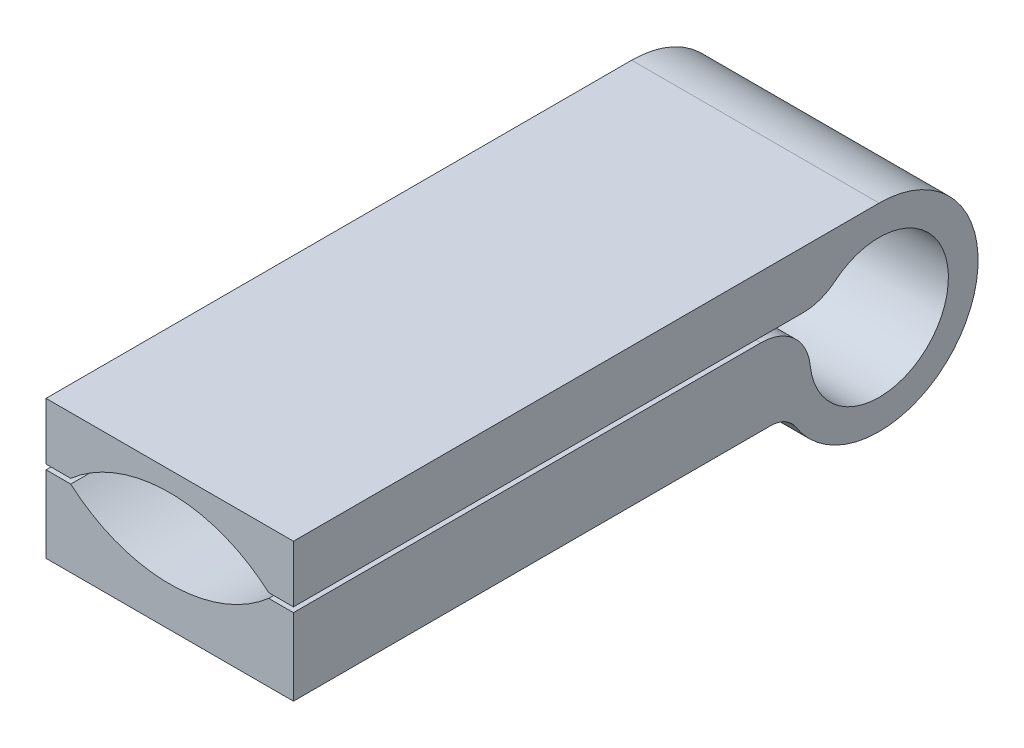
from build123d import *

# Parameters (mm, degrees)
BOSS_EXTRUDE2_DEPTH = 25
CUT_EXTRUDE1_REACH  = 76.865
SKETCH5_R           = 2.5
CUT_EXTRUDE4_DEPTH  = 51.520709


with BuildPart() as part:
    # Sketch2 → Boss-Extrude2 (new body)
    with BuildSketch(Plane(origin=(0, 0, 0), x_dir=(0, 0, -1), z_dir=(1, 0, 0))):
        with BuildLine():
            Line((0, 0), (59.16515139, 0))
            ThreePointArc((59.16515139, 0), (67.935731583, -14.803844614), (50.738650505, -15.384615385))
            ThreePointArc((50.738650505, -15.384615385), (49.651853624, -14.368825942), (48.21070024, -14))
            Line((48.21070024, -14), (45, -14))
            Line((45, -14), (0, -14))
            Line((0, -14), (0, -6.25))
            Line((0, -6.25), (47.230433128, -6.25))
            ThreePointArc((47.230433128, -6.25), (50.576761962, -7.534884479), (52.203232404, -10.729166667))
            ThreePointArc((52.203232404, -10.729166667), (65.645099511, -12.64769189), (54.705893308, -4.604166667))
            ThreePointArc((54.705893308, -4.604166667), (53.213216965, -5.454829079), (51.520708964, -5.75))
            Line((51.520708964, -5.75), (0, -5.75))
            Line((0, -5.75), (0, 0))
        make_face()
    extrude(amount=BOSS_EXTRUDE2_DEPTH)

    # Sketch5 → Cut-Extrude1 (cut, up to next)
    with BuildSketch(Plane.XZ.offset(14), mode=Mode.PRIVATE) as cut_extrude1_sk1:
        with Locations(Location((12.5, -30.56070024, 0), (0, 0, 270))):
            Circle(SKETCH5_R)
    cut_extrude1_tool1 = extrude(cut_extrude1_sk1.sketch, amount=-CUT_EXTRUDE1_REACH, mode=Mode.PRIVATE) & part.part
    # Sketch5 → Cut-Extrude1 (cut, up to next)
    with BuildSketch(Plane.XZ.offset(14), mode=Mode.PRIVATE) as cut_extrude1_sk2:
        with Locations(Location((12.5, -38.19070024, 0), (0, 0, 270))):
            Circle(SKETCH5_R)
    cut_extrude1_tool2 = extrude(cut_extrude1_sk2.sketch, amount=-CUT_EXTRUDE1_REACH, mode=Mode.PRIVATE) & part.part
    # Sketch5 → Cut-Extrude1 (cut, up to next)
    with BuildSketch(Plane.XZ.offset(14), mode=Mode.PRIVATE) as cut_extrude1_sk3:
        with Locations(Location((12.5, -44.84070024, 0), (0, 0, 270))):
            Circle(SKETCH5_R)
    cut_extrude1_tool3 = extrude(cut_extrude1_sk3.sketch, amount=-CUT_EXTRUDE1_REACH, mode=Mode.PRIVATE) & part.part
    add(cut_extrude1_tool1.solids().sort_by_distance((12.5, -14, -30.5607))[0], mode=Mode.SUBTRACT)
    add(cut_extrude1_tool2.solids().sort_by_distance((12.5, -14, -38.1907))[0], mode=Mode.SUBTRACT)
    add(cut_extrude1_tool3.solids().sort_by_distance((12.5, -14, -44.8407))[0], mode=Mode.SUBTRACT)

    # Sketch7 → Cut-Extrude4 (cut)
    with BuildSketch(Plane.XY):
        with BuildLine():
            Line((22.5, -6.25), (22.5, -5.75))
            ThreePointArc((22.5, -5.75), (12.5, -2), (2.5, -5.75))
            Line((2.5, -5.75), (2.5, -6.25))
            ThreePointArc((2.5, -6.25), (12.5, -10), (22.5, -6.25))
        make_face()
    extrude(amount=-CUT_EXTRUDE4_DEPTH, mode=Mode.SUBTRACT)


solid = part.part
